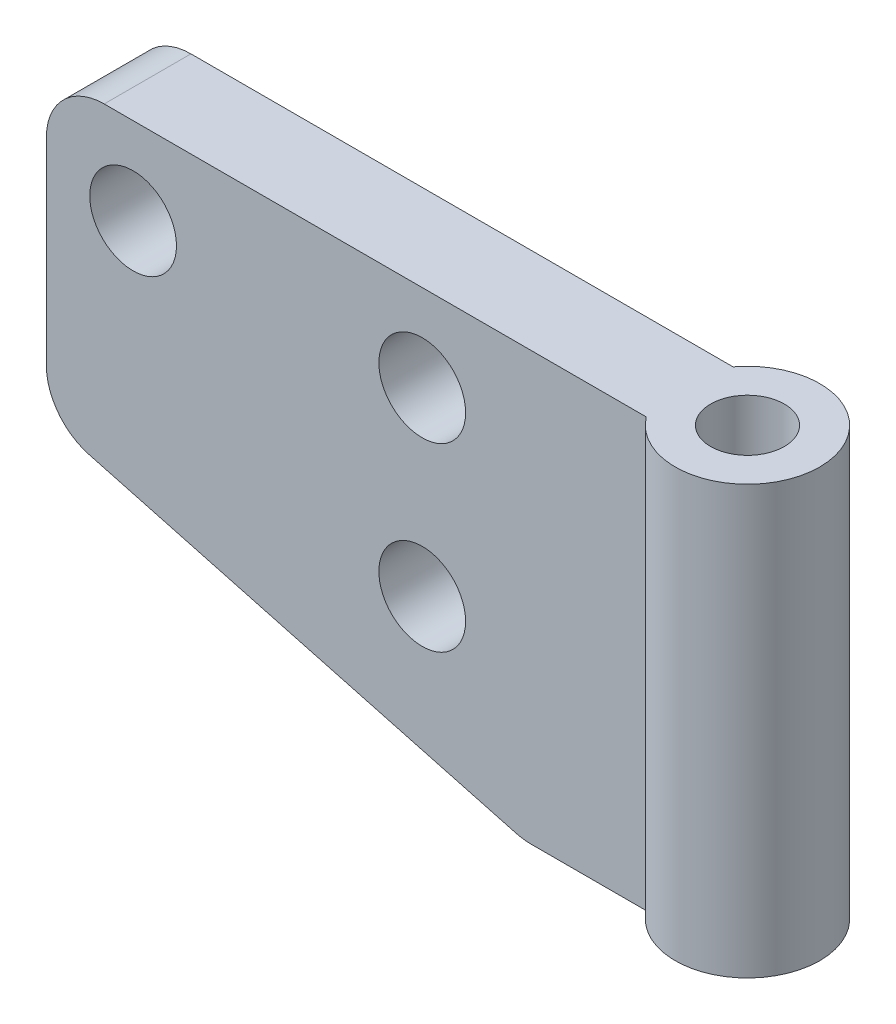
from build123d import *

# Parameters (mm, degrees)
SKETCH_2_R          = 3
EXTRUDE_1_DEPTH     = 6
SKETCH_3_R          = 5
EXTRUDE_2_DEPTH     = 29.58
SKETCH_4_R          = 2.55
CUT_EXTRUDE_1_DEPTH = 55.029865815


with BuildPart() as part:
    # 草图2 → 凸台-拉伸1 (new body)
    with BuildSketch(Plane.XY):
        with BuildLine():
            Line((26.49133381, -23.443703305), (-3.03527618, -15.532072003))
            ThreePointArc((-3.03527618, -15.532072003), (-5.173413361, -14.103414414), (-6, -11.668368698))
            Line((-6, -11.668368698), (-6, 2))
            ThreePointArc((-6, 2), (-4.828427125, 4.828427125), (-2, 6))
            Line((-2, 6), (39.5, 6))
            Line((39.5, 6), (39.5, -23.58))
            Line((39.5, -23.58), (27.52660999, -23.58))
            ThreePointArc((27.52660999, -23.58), (27.004505221, -23.545779445), (26.49133381, -23.443703305))
        make_face()
        Circle(SKETCH_2_R, mode=Mode.SUBTRACT)
        with Locations((20, 0)):
            Circle(SKETCH_2_R, mode=Mode.SUBTRACT)
        with Locations((20, -12.5)):
            Circle(SKETCH_2_R, mode=Mode.SUBTRACT)
    extrude(amount=EXTRUDE_1_DEPTH)

    # 草图3 → 凸台-拉伸2 (add, through all)
    with BuildSketch(Plane(origin=(0, 6, 0), x_dir=(1, 0, 0), z_dir=(0, 1, 0))):
        with Locations((39.5, -3)):
            Circle(SKETCH_3_R)
    extrude(amount=-EXTRUDE_2_DEPTH)

    # 草图4 → 切除-拉伸1 (cut, through all)
    with BuildSketch(Plane(origin=(0, 6, 0), x_dir=(1, 0, 0), z_dir=(0, 1, 0))):
        with Locations(Location((39.5, -3, 0), (0, 0, 270))):
            Circle(SKETCH_4_R)
    extrude(amount=-CUT_EXTRUDE_1_DEPTH, mode=Mode.SUBTRACT)


solid = part.part
